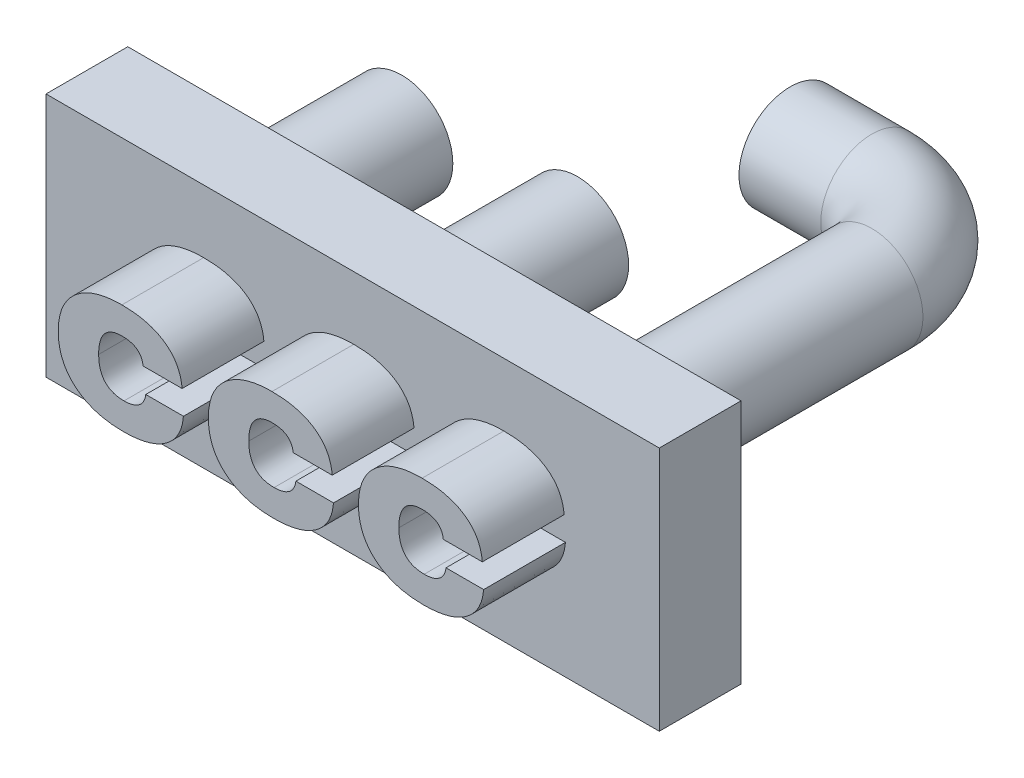
from build123d import *

# Parameters (mm, degrees)
SKETCH1_W           = 15
SKETCH1_H           = 6
BOSS_EXTRUDE1_DEPTH = 2
BOSS_EXTRUDE2_DEPTH = 2
SKETCH8_R           = 1.25
BOSS_EXTRUDE4_DEPTH = 4.5
SKETCH7_R           = 1.25
BOSS_EXTRUDE5_DEPTH = 4.5
SKETCH10_R          = 1.25


with BuildPart() as part:
    # Sketch1 → Boss-Extrude1 (new body)
    with BuildSketch(Plane.XY):
        Rectangle(SKETCH1_W, SKETCH1_H)
    extrude(amount=BOSS_EXTRUDE1_DEPTH)

    # Sketch2 → Boss-Extrude2 (add)
    with BuildSketch(Plane.XY.offset(2)):
        with BuildLine():
            Line((-3.060082731, -0.145888163), (-2.138122178, -0.145888163))
            add(Edge.make_bspline(
                [(-2.138122178, -0.145888163), (-2.142670856, -0.186817863), (-2.151591905, -0.267090827), (-2.177769169, -0.383345409), (-2.21581097, -0.492138159), (-2.263624462, -0.594453887), (-2.323094811, -0.689286262), (-2.393268208, -0.777226894), (-2.474496925, -0.857513187), (-2.56593251, -0.930702134), (-2.666921735, -0.996049335), (-2.776982197, -1.052595512), (-2.895454873, -1.100578301), (-3.022533127, -1.139544776), (-3.158112272, -1.169766838), (-3.302219404, -1.190920315), (-3.454592079, -1.204838445), (-3.559102892, -1.206109201), (-3.612641679, -1.206760184)],
                knots=[0, 0, 0, 0, 0.976829506, 1.915797078, 2.820653329, 3.707285315, 4.590388637, 5.470720937, 6.371504049, 7.295059075, 8.245589783, 9.221265507, 10.22720936, 11.275107911, 12.372107559, 13.52041678, 14.729759393, 16, 16, 16, 16], degree=3))
            add(Edge.make_bspline(
                [(-3.612641679, -1.206760184), (-3.672703037, -1.205681875), (-3.78980194, -1.203579545), (-3.960409691, -1.187028741), (-4.121131552, -1.159524222), (-4.272151379, -1.120467746), (-4.41338954, -1.070117311), (-4.545018014, -1.008999239), (-4.666052683, -0.9357143), (-4.759428604, -0.866298777), (-4.827861299, -0.80519677), (-4.876126049, -0.757629416), (-4.920907868, -0.707879294), (-4.961799812, -0.655502017), (-5.001017469, -0.602324328), (-5.03520084, -0.545835782), (-5.066531819, -0.487757573), (-5.095227297, -0.427867871), (-5.119706435, -0.365492075), (-5.141169611, -0.301230601), (-5.160246588, -0.235142926), (-5.173972983, -0.16652574), (-5.186283094, -0.096102513), (-5.194098935, -0.023574116), (-5.199662301, 0.050901618), (-5.200117214, 0.101226019), (-5.200348302, 0.126789902)],
                knots=[0, 0, 0, 0, 1.844349952, 3.595845402, 5.258382034, 6.847576437, 8.380255859, 9.857610627, 11.296535068, 12.718617156, 13.423703043, 14.112710587, 14.79899505, 15.477617194, 16.152961149, 16.826845299, 17.503194887, 18.179359879, 18.864977055, 19.559518563, 20.259847437, 20.975709944, 21.707382985, 22.454791923, 23.215062313, 24, 24, 24, 24], degree=3))
            add(Edge.make_bspline(
                [(-5.200348302, 0.126789902), (-5.20010237, 0.152180931), (-5.199614969, 0.202502272), (-5.194209089, 0.276824794), (-5.186092921, 0.349110093), (-5.174639319, 0.419303704), (-5.16060764, 0.487612395), (-5.142177766, 0.553751295), (-5.121526835, 0.618038985), (-5.096362936, 0.679989613), (-5.06892589, 0.74011142), (-5.037645758, 0.797974151), (-5.003916141, 0.854253903), (-4.966122932, 0.908133198), (-4.925686325, 0.960385835), (-4.880950125, 1.009688803), (-4.833769122, 1.057627908), (-4.766340776, 1.11879755), (-4.675008641, 1.189066666), (-4.555365546, 1.261581715), (-4.426723513, 1.323905616), (-4.288155058, 1.373282632), (-4.140527998, 1.412584115), (-3.983451282, 1.440688501), (-3.816730635, 1.457118665), (-3.702542629, 1.459248516), (-3.644025381, 1.460339989)],
                knots=[0, 0, 0, 0, 0.788949478, 1.563583616, 2.314590912, 3.048845008, 3.773225905, 4.480463959, 5.181590848, 5.870415235, 6.557195353, 7.234374924, 7.913502193, 8.595071886, 9.278472863, 9.965397725, 10.662604099, 11.368153272, 12.793402362, 14.235777976, 15.708930775, 17.227954371, 18.799982801, 20.451742852, 22.181645754, 24, 24, 24, 24], degree=3))
            add(Edge.make_bspline(
                [(-3.644025381, 1.460339989), (-3.590145407, 1.459654041), (-3.484967955, 1.458315025), (-3.331779518, 1.444898309), (-3.187282445, 1.425014513), (-3.051742807, 1.395613017), (-2.925065251, 1.357757509), (-2.807100237, 1.311399315), (-2.697988088, 1.256802381), (-2.597921972, 1.19407992), (-2.507288128, 1.123496152), (-2.42730916, 1.045048752), (-2.357479614, 0.959432927), (-2.298872924, 0.866301097), (-2.249803372, 0.766268305), (-2.212782576, 0.658660702), (-2.184664141, 0.544165897), (-2.175657871, 0.464783504), (-2.17104934, 0.42416334)],
                knots=[0, 0, 0, 0, 1.289638031, 2.517463008, 3.678757242, 4.779638757, 5.834372698, 6.840786757, 7.810284887, 8.751219913, 9.663723068, 10.555058948, 11.427779484, 12.302574037, 13.183982208, 14.089056298, 15.022165429, 16, 16, 16, 16], degree=3))
            Line((-2.17104934, 0.42416334), (-3.125937056, 0.42416334))
            add(Edge.make_bspline(
                [(-3.125937056, 0.42416334), (-3.127887549, 0.43930189), (-3.131710048, 0.468969842), (-3.142040136, 0.511730167), (-3.155998966, 0.551467781), (-3.173017188, 0.588472211), (-3.193630284, 0.622418347), (-3.217560825, 0.653683148), (-3.244880123, 0.682137249), (-3.275932903, 0.70732909), (-3.310313405, 0.72961548), (-3.347848304, 0.749134153), (-3.388701646, 0.76557697), (-3.432765481, 0.77899212), (-3.480105092, 0.789183756), (-3.530681368, 0.796119849), (-3.584421185, 0.801027394), (-3.621376024, 0.801535064), (-3.640423973, 0.801796736)],
                knots=[0, 0, 0, 0, 1.02792653, 2.014490992, 2.957386111, 3.862121815, 4.753924626, 5.627574869, 6.51019678, 7.405362218, 8.315615775, 9.266619089, 10.251558014, 11.278704828, 12.366648388, 13.51059177, 14.716862994, 16, 16, 16, 16], degree=3))
            add(Edge.make_bspline(
                [(-3.640423973, 0.801796736), (-3.66359615, 0.801322385), (-3.708533487, 0.800402487), (-3.773695909, 0.792761593), (-3.834173486, 0.779391176), (-3.890254475, 0.760839723), (-3.942034126, 0.737056913), (-3.989624331, 0.708404931), (-4.032399456, 0.67383737), (-4.070628025, 0.634091204), (-4.104105801, 0.588767942), (-4.133882485, 0.538692432), (-4.157647598, 0.482571167), (-4.177808251, 0.421494548), (-4.193663959, 0.355071069), (-4.204784234, 0.283334137), (-4.211575895, 0.206324597), (-4.212207123, 0.153214936), (-4.212533423, 0.125760928)],
                knots=[0, 0, 0, 0, 1.096253294, 2.125941888, 3.09853747, 4.02234602, 4.9155674, 5.789561441, 6.643741359, 7.510358195, 8.391630331, 9.304611926, 10.260406741, 11.268901007, 12.345516153, 13.487518248, 14.70122137, 16, 16, 16, 16], degree=3))
            add(Edge.make_bspline(
                [(-4.212533423, 0.125760928), (-4.212023732, 0.098820004), (-4.211034896, 0.046552836), (-4.20387538, -0.029304282), (-4.191745473, -0.100083864), (-4.174082766, -0.165772241), (-4.152269564, -0.226559049), (-4.125261299, -0.282308092), (-4.09338658, -0.333065066), (-4.056054059, -0.378504224), (-4.014296197, -0.419012114), (-3.96742428, -0.453622328), (-3.91626571, -0.483220184), (-3.860158566, -0.506780196), (-3.799647084, -0.525328362), (-3.73468148, -0.538434558), (-3.665177261, -0.547030055), (-3.617299342, -0.547812765), (-3.592576689, -0.548216932)],
                knots=[0, 0, 0, 0, 1.234472244, 2.394957414, 3.488022233, 4.52125041, 5.508253929, 6.443198368, 7.354559284, 8.248126489, 9.131859273, 10.013633023, 10.911406571, 11.833948595, 12.795981492, 13.807064445, 14.867636965, 16, 16, 16, 16], degree=3))
            add(Edge.make_bspline(
                [(-3.592576689, -0.548216932), (-3.573523043, -0.548008488), (-3.53637073, -0.547602048), (-3.482331036, -0.541902553), (-3.431051927, -0.534930223), (-3.383278569, -0.522562968), (-3.338007293, -0.508440572), (-3.295951089, -0.490511601), (-3.256998066, -0.469088819), (-3.220875063, -0.445176153), (-3.188314834, -0.417525473), (-3.158686185, -0.387396389), (-3.133666577, -0.353410241), (-3.111160748, -0.317572759), (-3.093383205, -0.278451413), (-3.078216775, -0.23709906), (-3.066824033, -0.192623437), (-3.06236613, -0.161718235), (-3.060082731, -0.145888163)],
                knots=[0, 0, 0, 0, 1.233312579, 2.404810797, 3.516940584, 4.580999436, 5.596108869, 6.586365755, 7.535726907, 8.472201243, 9.38661427, 10.29778373, 11.201885539, 12.11434029, 13.033597211, 13.978725792, 14.964675429, 16, 16, 16, 16], degree=3))
        make_face()
        with BuildLine():
            Line((0.611295902, -0.145888163), (1.533256455, -0.145888163))
            add(Edge.make_bspline(
                [(1.533256455, -0.145888163), (1.528707777, -0.186817863), (1.519786728, -0.267090827), (1.493609464, -0.383345409), (1.455567663, -0.492138159), (1.407754171, -0.594453887), (1.348283822, -0.689286262), (1.278110424, -0.777226894), (1.196881708, -0.857513187), (1.105446123, -0.930702134), (1.004456897, -0.996049335), (0.894396436, -1.052595512), (0.775923759, -1.100578301), (0.648845506, -1.139544776), (0.51326636, -1.169766838), (0.369159229, -1.190920315), (0.216786554, -1.204838445), (0.112275741, -1.206109201), (0.058736954, -1.206760184)],
                knots=[0, 0, 0, 0, 0.976829506, 1.915797078, 2.820653329, 3.707285315, 4.590388637, 5.470720937, 6.371504049, 7.295059075, 8.245589783, 9.221265507, 10.22720936, 11.275107911, 12.372107559, 13.52041678, 14.729759393, 16, 16, 16, 16], degree=3))
            add(Edge.make_bspline(
                [(0.058736954, -1.206760184), (-0.001324404, -1.205681875), (-0.118423307, -1.203579545), (-0.289031058, -1.187028741), (-0.449752919, -1.159524222), (-0.600772746, -1.120467746), (-0.742010907, -1.070117311), (-0.873639381, -1.008999239), (-0.99467405, -0.9357143), (-1.088049971, -0.866298777), (-1.156482666, -0.80519677), (-1.204747416, -0.757629416), (-1.249529235, -0.707879294), (-1.290421179, -0.655502017), (-1.329638836, -0.602324328), (-1.363822207, -0.545835782), (-1.395153186, -0.487757573), (-1.423848664, -0.427867871), (-1.448327802, -0.365492075), (-1.469790978, -0.301230601), (-1.488867955, -0.235142926), (-1.50259435, -0.16652574), (-1.514904461, -0.096102513), (-1.522720303, -0.023574116), (-1.528283668, 0.050901618), (-1.528738581, 0.101226019), (-1.528969669, 0.126789902)],
                knots=[0, 0, 0, 0, 1.844349952, 3.595845402, 5.258382034, 6.847576437, 8.380255859, 9.857610627, 11.296535068, 12.718617156, 13.423703043, 14.112710587, 14.79899505, 15.477617194, 16.152961149, 16.826845299, 17.503194887, 18.179359879, 18.864977055, 19.559518563, 20.259847437, 20.975709944, 21.707382985, 22.454791923, 23.215062313, 24, 24, 24, 24], degree=3))
            add(Edge.make_bspline(
                [(-1.528969669, 0.126789902), (-1.528723737, 0.152180931), (-1.528236336, 0.202502272), (-1.522830456, 0.276824794), (-1.514714289, 0.349110093), (-1.503260687, 0.419303704), (-1.489229007, 0.487612395), (-1.470799133, 0.553751295), (-1.450148202, 0.618038985), (-1.424984304, 0.679989613), (-1.397547257, 0.74011142), (-1.366267126, 0.797974151), (-1.332537508, 0.854253903), (-1.294744299, 0.908133198), (-1.254307692, 0.960385835), (-1.209571492, 1.009688803), (-1.162390489, 1.057627908), (-1.094962143, 1.11879755), (-1.003630008, 1.189066666), (-0.883986913, 1.261581715), (-0.75534488, 1.323905616), (-0.616776425, 1.373282632), (-0.469149365, 1.412584115), (-0.312072649, 1.440688501), (-0.145352002, 1.457118665), (-0.031163997, 1.459248516), (0.027353252, 1.460339989)],
                knots=[0, 0, 0, 0, 0.788949478, 1.563583616, 2.314590912, 3.048845008, 3.773225905, 4.480463959, 5.181590848, 5.870415235, 6.557195353, 7.234374924, 7.913502193, 8.595071886, 9.278472863, 9.965397725, 10.662604099, 11.368153272, 12.793402362, 14.235777976, 15.708930775, 17.227954371, 18.799982801, 20.451742852, 22.181645754, 24, 24, 24, 24], degree=3))
            add(Edge.make_bspline(
                [(0.027353252, 1.460339989), (0.081233226, 1.459654041), (0.186410678, 1.458315025), (0.339599115, 1.444898309), (0.484096188, 1.425014513), (0.619635826, 1.395613017), (0.746313382, 1.357757509), (0.864278396, 1.311399315), (0.973390545, 1.256802381), (1.073456661, 1.19407992), (1.164090505, 1.123496152), (1.244069473, 1.045048752), (1.313899019, 0.959432927), (1.372505709, 0.866301097), (1.421575261, 0.766268305), (1.458596057, 0.658660702), (1.486714492, 0.544165897), (1.495720762, 0.464783504), (1.500329293, 0.42416334)],
                knots=[0, 0, 0, 0, 1.289638031, 2.517463008, 3.678757242, 4.779638757, 5.834372698, 6.840786757, 7.810284887, 8.751219913, 9.663723068, 10.555058948, 11.427779484, 12.302574037, 13.183982208, 14.089056298, 15.022165429, 16, 16, 16, 16], degree=3))
            Line((1.500329293, 0.42416334), (0.545441576, 0.42416334))
            add(Edge.make_bspline(
                [(0.545441576, 0.42416334), (0.543491084, 0.43930189), (0.539668585, 0.468969842), (0.529338497, 0.511730167), (0.515379666, 0.551467781), (0.498361445, 0.588472211), (0.477748349, 0.622418347), (0.453817808, 0.653683148), (0.42649851, 0.682137249), (0.39544573, 0.70732909), (0.361065228, 0.72961548), (0.323530328, 0.749134153), (0.282676987, 0.76557697), (0.238613151, 0.77899212), (0.191273541, 0.789183756), (0.140697265, 0.796119849), (0.086957447, 0.801027394), (0.050002609, 0.801535064), (0.03095466, 0.801796736)],
                knots=[0, 0, 0, 0, 1.02792653, 2.014490992, 2.957386111, 3.862121815, 4.753924626, 5.627574869, 6.51019678, 7.405362218, 8.315615775, 9.266619089, 10.251558014, 11.278704828, 12.366648388, 13.51059177, 14.716862994, 16, 16, 16, 16], degree=3))
            add(Edge.make_bspline(
                [(0.03095466, 0.801796736), (0.007782483, 0.801322385), (-0.037154854, 0.800402487), (-0.102317276, 0.792761593), (-0.162794853, 0.779391176), (-0.218875842, 0.760839723), (-0.270655493, 0.737056913), (-0.318245698, 0.708404931), (-0.361020823, 0.67383737), (-0.399249392, 0.634091204), (-0.432727168, 0.588767942), (-0.462503853, 0.538692432), (-0.486268965, 0.482571167), (-0.506429618, 0.421494548), (-0.522285326, 0.355071069), (-0.533405601, 0.283334137), (-0.540197262, 0.206324597), (-0.54082849, 0.153214936), (-0.54115479, 0.125760928)],
                knots=[0, 0, 0, 0, 1.096253294, 2.125941888, 3.09853747, 4.02234602, 4.9155674, 5.789561441, 6.643741359, 7.510358195, 8.391630331, 9.304611926, 10.260406741, 11.268901007, 12.345516153, 13.487518248, 14.70122137, 16, 16, 16, 16], degree=3))
            add(Edge.make_bspline(
                [(-0.54115479, 0.125760928), (-0.540645099, 0.098820004), (-0.539656263, 0.046552836), (-0.532496747, -0.029304282), (-0.52036684, -0.100083864), (-0.502704133, -0.165772241), (-0.480890931, -0.226559049), (-0.453882667, -0.282308092), (-0.422007947, -0.333065066), (-0.384675426, -0.378504224), (-0.342917564, -0.419012114), (-0.296045647, -0.453622328), (-0.244887077, -0.483220184), (-0.188779933, -0.506780196), (-0.128268451, -0.525328362), (-0.063302847, -0.538434558), (0.006201372, -0.547030055), (0.054079291, -0.547812765), (0.078801944, -0.548216932)],
                knots=[0, 0, 0, 0, 1.234472244, 2.394957414, 3.488022233, 4.52125041, 5.508253929, 6.443198368, 7.354559284, 8.248126489, 9.131859273, 10.013633023, 10.911406571, 11.833948595, 12.795981492, 13.807064445, 14.867636965, 16, 16, 16, 16], degree=3))
            add(Edge.make_bspline(
                [(0.078801944, -0.548216932), (0.09785559, -0.548008488), (0.135007902, -0.547602048), (0.189047596, -0.541902553), (0.240326706, -0.534930223), (0.288100063, -0.522562968), (0.33337134, -0.508440572), (0.375427544, -0.490511601), (0.414380567, -0.469088819), (0.45050357, -0.445176153), (0.483063798, -0.417525473), (0.512692448, -0.387396389), (0.537712056, -0.353410241), (0.560217885, -0.317572759), (0.577995428, -0.278451413), (0.593161858, -0.23709906), (0.6045546, -0.192623437), (0.609012502, -0.161718235), (0.611295902, -0.145888163)],
                knots=[0, 0, 0, 0, 1.233312579, 2.404810797, 3.516940584, 4.580999436, 5.596108869, 6.586365755, 7.535726907, 8.472201243, 9.38661427, 10.29778373, 11.201885539, 12.11434029, 13.033597211, 13.978725792, 14.964675429, 16, 16, 16, 16], degree=3))
        make_face()
        with BuildLine():
            Line((4.282674535, -0.145888163), (5.204635088, -0.145888163))
            add(Edge.make_bspline(
                [(5.204635088, -0.145888163), (5.20008641, -0.186817863), (5.191165361, -0.267090827), (5.164988097, -0.383345409), (5.126946296, -0.492138159), (5.079132804, -0.594453887), (5.019662455, -0.689286262), (4.949489057, -0.777226894), (4.868260341, -0.857513187), (4.776824756, -0.930702134), (4.67583553, -0.996049335), (4.565775069, -1.052595512), (4.447302392, -1.100578301), (4.320224139, -1.139544776), (4.184644993, -1.169766838), (4.040537862, -1.190920315), (3.888165187, -1.204838445), (3.783654374, -1.206109201), (3.730115587, -1.206760184)],
                knots=[0, 0, 0, 0, 0.976829506, 1.915797078, 2.820653329, 3.707285315, 4.590388637, 5.470720937, 6.371504049, 7.295059075, 8.245589783, 9.221265507, 10.22720936, 11.275107911, 12.372107559, 13.52041678, 14.729759393, 16, 16, 16, 16], degree=3))
            add(Edge.make_bspline(
                [(3.730115587, -1.206760184), (3.670054229, -1.205681875), (3.552955326, -1.203579545), (3.382347575, -1.187028741), (3.221625714, -1.159524222), (3.070605887, -1.120467746), (2.929367726, -1.070117311), (2.797739252, -1.008999239), (2.676704583, -0.9357143), (2.583328662, -0.866298777), (2.514895967, -0.80519677), (2.466631217, -0.757629416), (2.421849398, -0.707879294), (2.380957454, -0.655502017), (2.341739797, -0.602324328), (2.307556425, -0.545835782), (2.276225447, -0.487757573), (2.247529968, -0.427867871), (2.223050831, -0.365492075), (2.201587655, -0.301230601), (2.182510678, -0.235142926), (2.168784283, -0.16652574), (2.156474172, -0.096102513), (2.14865833, -0.023574116), (2.143094965, 0.050901618), (2.142640052, 0.101226019), (2.142408964, 0.126789902)],
                knots=[0, 0, 0, 0, 1.844349952, 3.595845402, 5.258382034, 6.847576437, 8.380255859, 9.857610627, 11.296535068, 12.718617156, 13.423703043, 14.112710587, 14.79899505, 15.477617194, 16.152961149, 16.826845299, 17.503194887, 18.179359879, 18.864977055, 19.559518563, 20.259847437, 20.975709944, 21.707382985, 22.454791923, 23.215062313, 24, 24, 24, 24], degree=3))
            add(Edge.make_bspline(
                [(2.142408964, 0.126789902), (2.142654896, 0.152180931), (2.143142297, 0.202502272), (2.148548177, 0.276824794), (2.156664344, 0.349110093), (2.168117946, 0.419303704), (2.182149625, 0.487612395), (2.2005795, 0.553751295), (2.221230431, 0.618038985), (2.246394329, 0.679989613), (2.273831375, 0.74011142), (2.305111507, 0.797974151), (2.338841125, 0.854253903), (2.376634334, 0.908133198), (2.417070941, 0.960385835), (2.461807141, 1.009688803), (2.508988144, 1.057627908), (2.57641649, 1.11879755), (2.667748625, 1.189066666), (2.78739172, 1.261581715), (2.916033753, 1.323905616), (3.054602208, 1.373282632), (3.202229268, 1.412584115), (3.359305984, 1.440688501), (3.52602663, 1.457118665), (3.640214636, 1.459248516), (3.698731885, 1.460339989)],
                knots=[0, 0, 0, 0, 0.788949478, 1.563583616, 2.314590912, 3.048845008, 3.773225905, 4.480463959, 5.181590848, 5.870415235, 6.557195353, 7.234374924, 7.913502193, 8.595071886, 9.278472863, 9.965397725, 10.662604099, 11.368153272, 12.793402362, 14.235777976, 15.708930775, 17.227954371, 18.799982801, 20.451742852, 22.181645754, 24, 24, 24, 24], degree=3))
            add(Edge.make_bspline(
                [(3.698731885, 1.460339989), (3.752611859, 1.459654041), (3.857789311, 1.458315025), (4.010977748, 1.444898309), (4.155474821, 1.425014513), (4.291014459, 1.395613017), (4.417692015, 1.357757509), (4.535657029, 1.311399315), (4.644769178, 1.256802381), (4.744835294, 1.19407992), (4.835469138, 1.123496152), (4.915448106, 1.045048752), (4.985277651, 0.959432927), (5.043884342, 0.866301097), (5.092953894, 0.766268305), (5.12997469, 0.658660702), (5.158093125, 0.544165897), (5.167099395, 0.464783504), (5.171707925, 0.42416334)],
                knots=[0, 0, 0, 0, 1.289638031, 2.517463008, 3.678757242, 4.779638757, 5.834372698, 6.840786757, 7.810284887, 8.751219913, 9.663723068, 10.555058948, 11.427779484, 12.302574037, 13.183982208, 14.089056298, 15.022165429, 16, 16, 16, 16], degree=3))
            Line((5.171707925, 0.42416334), (4.216820209, 0.42416334))
            add(Edge.make_bspline(
                [(4.216820209, 0.42416334), (4.214869717, 0.43930189), (4.211047218, 0.468969842), (4.20071713, 0.511730167), (4.186758299, 0.551467781), (4.169740078, 0.588472211), (4.149126982, 0.622418347), (4.125196441, 0.653683148), (4.097877142, 0.682137249), (4.066824363, 0.70732909), (4.032443861, 0.72961548), (3.994908961, 0.749134153), (3.95405562, 0.76557697), (3.909991784, 0.77899212), (3.862652174, 0.789183756), (3.812075898, 0.796119849), (3.75833608, 0.801027394), (3.721381242, 0.801535064), (3.702333293, 0.801796736)],
                knots=[0, 0, 0, 0, 1.02792653, 2.014490992, 2.957386111, 3.862121815, 4.753924626, 5.627574869, 6.51019678, 7.405362218, 8.315615775, 9.266619089, 10.251558014, 11.278704828, 12.366648388, 13.51059177, 14.716862994, 16, 16, 16, 16], degree=3))
            add(Edge.make_bspline(
                [(3.702333293, 0.801796736), (3.679161115, 0.801322385), (3.634223779, 0.800402487), (3.569061357, 0.792761593), (3.50858378, 0.779391176), (3.452502791, 0.760839723), (3.400723139, 0.737056913), (3.353132935, 0.708404931), (3.31035781, 0.67383737), (3.272129241, 0.634091204), (3.238651465, 0.588767942), (3.20887478, 0.538692432), (3.185109668, 0.482571167), (3.164949015, 0.421494548), (3.149093307, 0.355071069), (3.137973032, 0.283334137), (3.13118137, 0.206324597), (3.130550143, 0.153214936), (3.130223843, 0.125760928)],
                knots=[0, 0, 0, 0, 1.096253294, 2.125941888, 3.09853747, 4.02234602, 4.9155674, 5.789561441, 6.643741359, 7.510358195, 8.391630331, 9.304611926, 10.260406741, 11.268901007, 12.345516153, 13.487518248, 14.70122137, 16, 16, 16, 16], degree=3))
            add(Edge.make_bspline(
                [(3.130223843, 0.125760928), (3.130733534, 0.098820004), (3.131722369, 0.046552836), (3.138881885, -0.029304282), (3.151011793, -0.100083864), (3.1686745, -0.165772241), (3.190487702, -0.226559049), (3.217495966, -0.282308092), (3.249370686, -0.333065066), (3.286703207, -0.378504224), (3.328461069, -0.419012114), (3.375332985, -0.453622328), (3.426491556, -0.483220184), (3.4825987, -0.506780196), (3.543110182, -0.525328362), (3.608075786, -0.538434558), (3.677580005, -0.547030055), (3.725457923, -0.547812765), (3.750180576, -0.548216932)],
                knots=[0, 0, 0, 0, 1.234472244, 2.394957414, 3.488022233, 4.52125041, 5.508253929, 6.443198368, 7.354559284, 8.248126489, 9.131859273, 10.013633023, 10.911406571, 11.833948595, 12.795981492, 13.807064445, 14.867636965, 16, 16, 16, 16], degree=3))
            add(Edge.make_bspline(
                [(3.750180576, -0.548216932), (3.769234223, -0.548008488), (3.806386535, -0.547602048), (3.860426229, -0.541902553), (3.911705338, -0.534930223), (3.959478696, -0.522562968), (4.004749973, -0.508440572), (4.046806177, -0.490511601), (4.0857592, -0.469088819), (4.121882203, -0.445176153), (4.154442431, -0.417525473), (4.184071081, -0.387396389), (4.209090689, -0.353410241), (4.231596518, -0.317572759), (4.249374061, -0.278451413), (4.264540491, -0.23709906), (4.275933233, -0.192623437), (4.280391135, -0.161718235), (4.282674535, -0.145888163)],
                knots=[0, 0, 0, 0, 1.233312579, 2.404810797, 3.516940584, 4.580999436, 5.596108869, 6.586365755, 7.535726907, 8.472201243, 9.38661427, 10.29778373, 11.201885539, 12.11434029, 13.033597211, 13.978725792, 14.964675429, 16, 16, 16, 16], degree=3))
        make_face()
    extrude(amount=BOSS_EXTRUDE2_DEPTH)

    # Sketch8 → Boss-Extrude4 (add)
    with BuildSketch(Plane(origin=(0, 0, 0), x_dir=(-1, 0, 0), z_dir=(0, 0, -1))):
        with Locations(Location((1, 0, 0), (0, 0, 180))):
            Circle(SKETCH8_R)
    extrude(amount=BOSS_EXTRUDE4_DEPTH)

    # Sketch7 → Boss-Extrude5 (add)
    with BuildSketch(Plane(origin=(0, 0, 0), x_dir=(-1, 0, 0), z_dir=(0, 0, -1))):
        with Locations(Location((5.3, 0, 0), (0, 0, 180))):
            Circle(SKETCH7_R)
    extrude(amount=BOSS_EXTRUDE5_DEPTH)

    # Sweep4: sweep along a path in Sketch9
    with BuildLine(Plane(origin=(0, 0, 0), x_dir=(1, 0, 0), z_dir=(0, 1, 0))) as sweep4_path:
        Line((3.698731885, -0.224939091), (3.698731885, 7))
        ThreePointArc((3.698731885, 7), (3.112945447, 8.414213562), (1.698731885, 9))
        Line((1.698731885, 9), (-0.301268115, 9))
    # Sketch10 → Sweep4 (sweep)
    with BuildSketch(Plane(origin=(0, 0, 0), x_dir=(-1, 0, 0), z_dir=(0, 0, -1))):
        with Locations((-3.698731885, 0)):
            Circle(SKETCH10_R)
    sweep(path=sweep4_path.line)


solid = part.part
